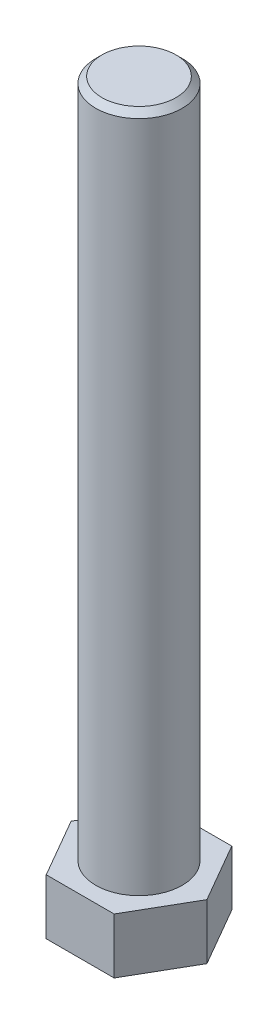
from build123d import *

# Parameters (mm, degrees)
SALIENTE_EXTRUIR1_DEPTH = 8.98
CROQUIS2_R              = 7
SALIENTE_EXTRUIR3_DEPTH = 110
CHAFL_N4_SIZE           = 1


with BuildPart() as part:
    # Croquis1 → Saliente-Extruir1 (new body)
    with BuildSketch(Plane(origin=(0, 0, 0), x_dir=(1, 0, 0), z_dir=(0, 1, 0))):
        Polygon((11, 0), (5.5, 9.526279442), (-5.5, 9.526279442), (-11, 0), (-5.5, -9.526279442), (5.5, -9.526279442), align=None)
    extrude(amount=SALIENTE_EXTRUIR1_DEPTH)

    # Croquis2 → Saliente-Extruir3 (add)
    with BuildSketch(Plane(origin=(0, 8.98, 0), x_dir=(1, 0, 0), z_dir=(0, 1, 0))):
        with Locations(Location((0, 0, 0), (0, 0, 270))):
            Circle(CROQUIS2_R)
    extrude(amount=SALIENTE_EXTRUIR3_DEPTH)

    # Chaflán4
    chafl_n4_edges = [part.edges().sort_by_distance(p)[0] for p in [
        (0, 118.98, -7),
    ]]
    chamfer(chafl_n4_edges, length=CHAFL_N4_SIZE)


solid = part.part
